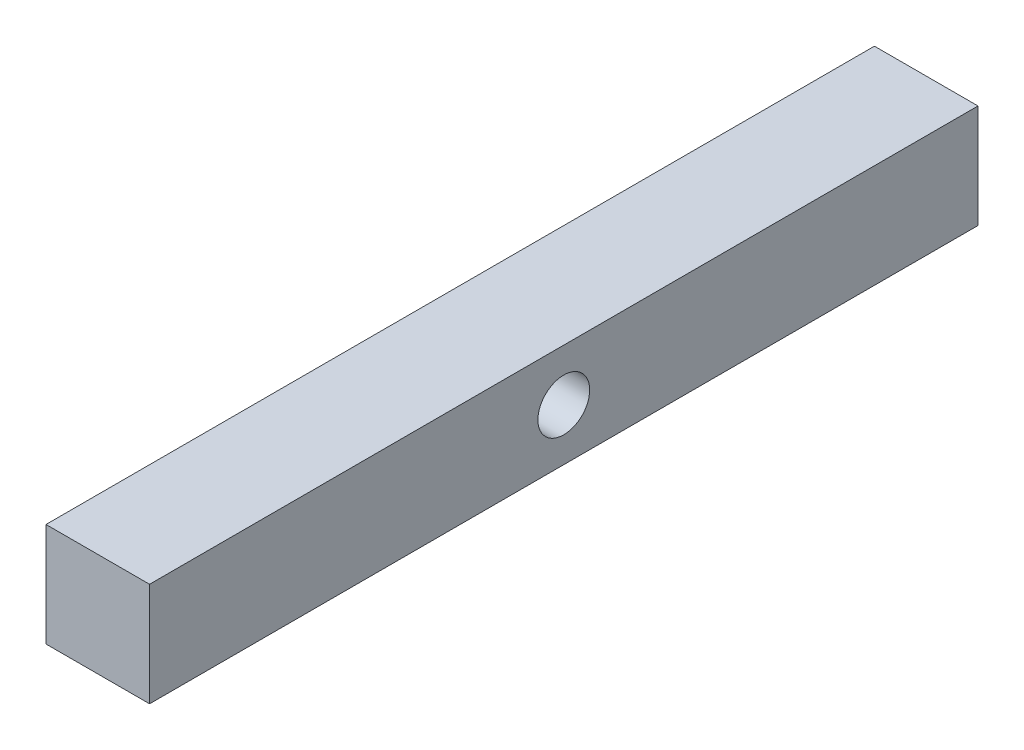
from build123d import *

# Parameters (mm, degrees)
SKETCH1_W           = 40
SKETCH1_H           = 40
BOSS_EXTRUDE1_DEPTH = 320
SKETCH3_R           = 10
CUT_EXTRUDE2_DEPTH  = 240


with BuildPart() as part:
    # Sketch1 → Boss-Extrude1 (new body)
    with BuildSketch(Plane.XY):
        Rectangle(SKETCH1_W, SKETCH1_H)
    extrude(amount=BOSS_EXTRUDE1_DEPTH)

    # Sketch3 → Cut-Extrude2 (cut)
    with BuildSketch(Plane(origin=(20, 0, 0), x_dir=(0, 0, -1), z_dir=(1, 0, 0))):
        with Locations((-160, 0)):
            Circle(SKETCH3_R)
    extrude(amount=-CUT_EXTRUDE2_DEPTH, mode=Mode.SUBTRACT)


solid = part.part
